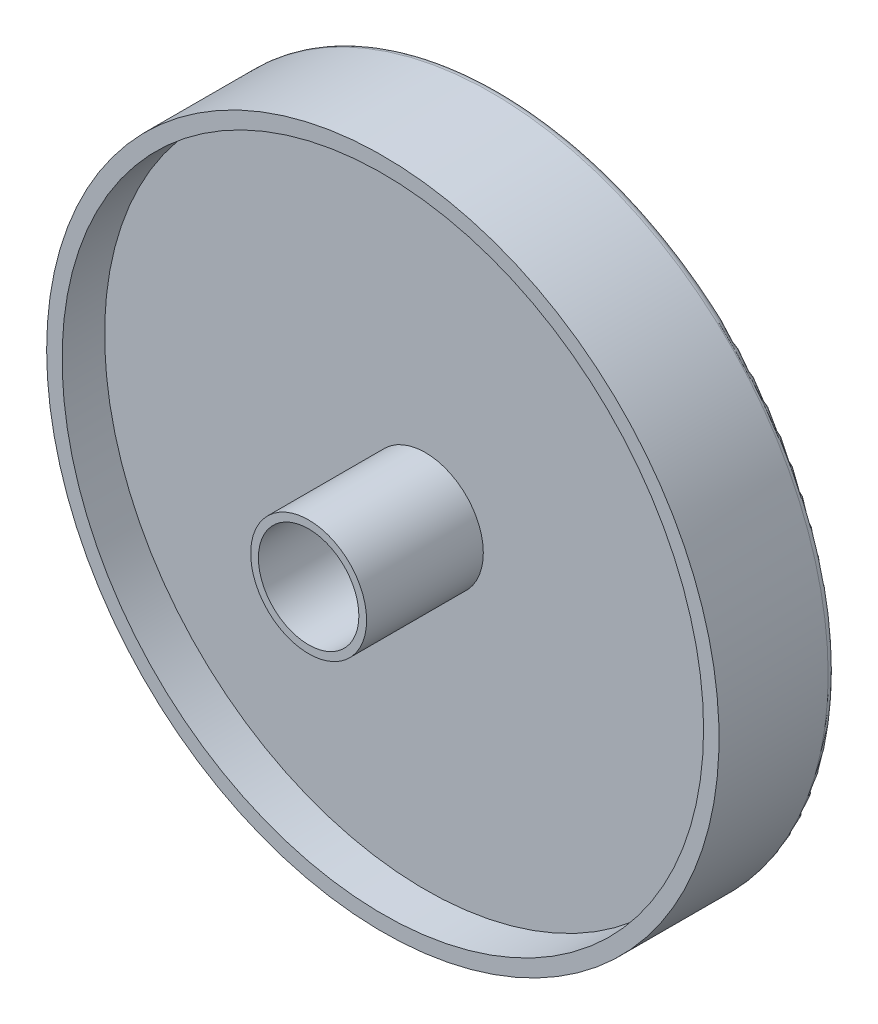
from build123d import *

# Parameters (mm, degrees)
SKETCH_2_R          = 41.5
CUT_EXTRUDE_1_DEPTH = 13
SKETCH_3_R          = 6.5
CUT_EXTRUDE_2_DEPTH = 65.097581858
SKETCH_4_R          = 7.5
SKETCH_4_R_2        = 6.5
EXTRUDE_1_DEPTH     = 22.6
M3X0_51_D           = 2.5
FILLET_1_R          = 1
SKETCH_8_R          = 41.5
SKETCH_8_R_2        = 7.5
EXTRUDE_2_DEPTH     = 7.5


with BuildPart() as part:
    # Эскиз1 → Повернуть1 (revolve)
    with BuildSketch(Plane(origin=(0, 0, 0), x_dir=(1, 0, 0), z_dir=(0, 1, 0))):
        Polygon((0, 0), (-43.5, 0), (-43.5, 15), (-20, 18), (0, 18), align=None)
    revolve(axis=Axis((0, 0, -18), (0, 0, 1)))

    # Эскиз2 → Вырез-Вытянуть1 (cut)
    with BuildSketch(Plane.XY):
        Circle(SKETCH_2_R)
    extrude(amount=-CUT_EXTRUDE_1_DEPTH, mode=Mode.SUBTRACT)

    # Эскиз3 → Вырез-Вытянуть2 (cut, through all)
    with BuildSketch(Plane(origin=(0, 0, -18), x_dir=(-1, 0, 0), z_dir=(0, 0, -1))):
        Circle(SKETCH_3_R)
    extrude(amount=-CUT_EXTRUDE_2_DEPTH, mode=Mode.SUBTRACT)

    # Эскиз4 → Бобышка-Вытянуть1 (add)
    with BuildSketch(Plane.XY.offset(-13)):
        Circle(SKETCH_4_R)
        with Locations(Location((0, 0, 0), (0, 0, 180))):
            Circle(SKETCH_4_R_2, mode=Mode.SUBTRACT)
    extrude(amount=EXTRUDE_1_DEPTH)

    # Отверстие обработанное метчиком M3x0.51 (through all)
    with Locations(Plane(origin=(0, 0, -18), x_dir=(-1, 0, 0), z_dir=(0, 0, -1))):
        with Locations((-12.374368671, 12.374368671), (0, 17.5), (12.374368671, 12.374368671), (17.5, 0), (12.374368671, -12.374368671), (0, -17.5), (-12.374368671, -12.374368671), (-17.5, 0), (-12.5, 0), (0, 12.5), (12.5, 0), (0, -12.5)):
            Hole(M3X0_51_D / 2)

    # Скругление1
    fillet_1_edges = [part.edges().sort_by_distance(p)[0] for p in [
        (20, 0, -18),
        (43.5, 0, -15),
    ]]
    fillet(fillet_1_edges, radius=FILLET_1_R)

    # Эскиз8 → Бобышка-Вытянуть2 (add)
    with BuildSketch(Plane.XY.offset(-13)):
        Circle(SKETCH_8_R)
        Circle(SKETCH_8_R_2, mode=Mode.SUBTRACT)
    extrude(amount=EXTRUDE_2_DEPTH)


solid = part.part
